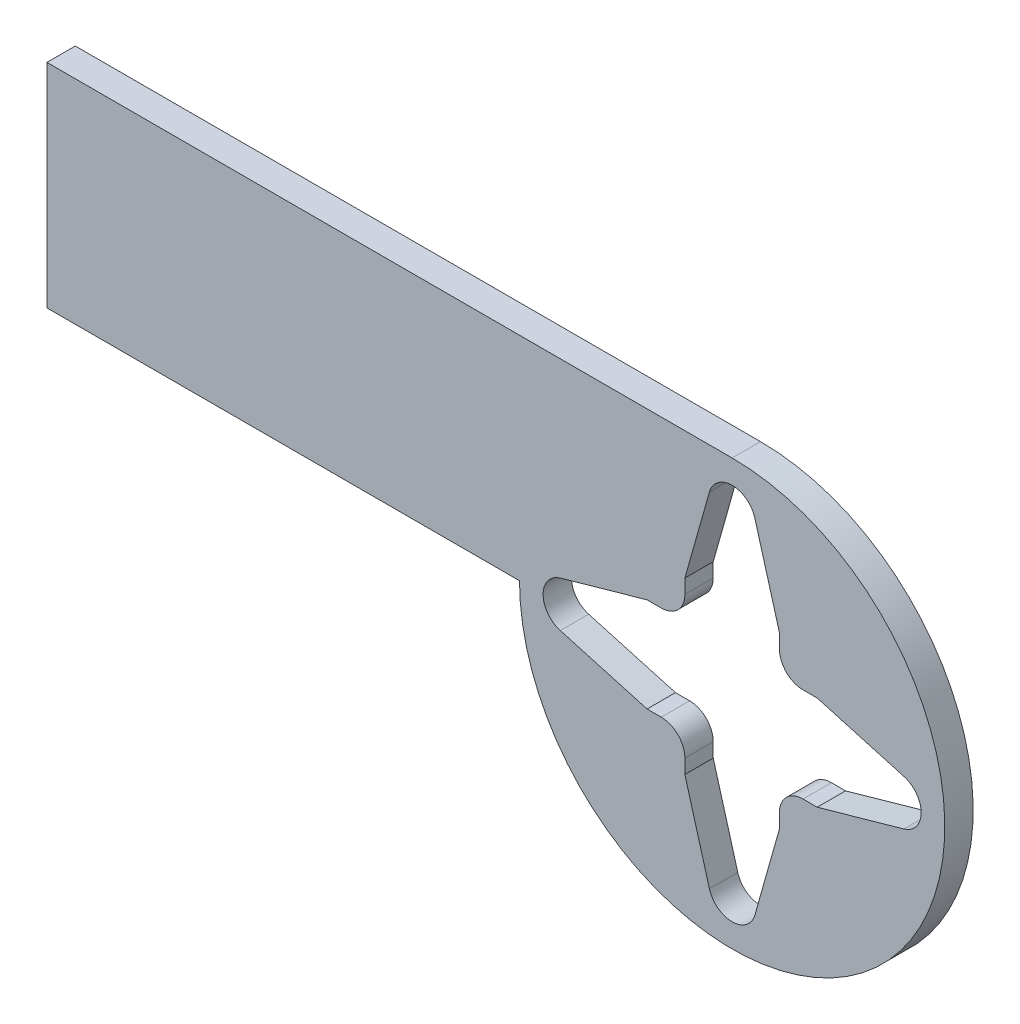
from build123d import *

# Parameters (mm, degrees)
SKETCH1_R           = 2.5
SKETCH1_W           = 50
SKETCH1_H           = 22.5
BOSS_EXTRUDE1_DEPTH = 3


with BuildPart() as part:
    # Sketch1 → Boss-Extrude1 (new body)
    # profile 1 of 7: a face of its own
    with BuildSketch(Plane.XY):
        with BuildLine():
            ThreePointArc((22.5, 0), (15.909902577, 15.909902577), (0, 22.5))
            Line((0, 22.5), (-22.5, 0))
            ThreePointArc((-22.5, 0), (-22.471786645, -1.126412439), (-22.387217335, -2.25))
            ThreePointArc((-22.387217335, -2.25), (1.126412439, -22.471786645), (22.5, 0))
        make_face()
        with BuildLine():
            ThreePointArc((-7.5, 5), (-9.267766953, 9.267766953), (-5, 7.5))
            Line((-5, 7.5), (-5, 9))
            Line((-5, 9), (-2.405779746, 18.179870439))
            ThreePointArc((-2.405779746, 18.179870439), (0, 20), (2.405779746, 18.179870439))
            Line((2.405779746, 18.179870439), (5, 9))
            Line((5, 9), (5, 7.5))
            ThreePointArc((5, 7.5), (7.5, 10), (10, 7.5))
            ThreePointArc((10, 7.5), (9.267766953, 5.732233047), (7.5, 5))
            Line((7.5, 5), (9, 5))
            Line((9, 5), (18.179870439, 2.405779746))
            ThreePointArc((18.179870439, 2.405779746), (19.493699588, 1.508363998), (20, 0))
            ThreePointArc((20, 0), (19.493699588, -1.508363998), (18.179870439, -2.405779746))
            Line((18.179870439, -2.405779746), (9, -5))
            Line((9, -5), (7.5, -5))
            ThreePointArc((7.5, -5), (9.267766953, -5.732233047), (10, -7.5))
            ThreePointArc((10, -7.5), (7.5, -10), (5, -7.5))
            Line((5, -7.5), (5, -9))
            Line((5, -9), (2.405779746, -18.179870439))
            ThreePointArc((2.405779746, -18.179870439), (0, -20), (-2.405779746, -18.179870439))
            Line((-2.405779746, -18.179870439), (-5, -9))
            Line((-5, -9), (-5, -7.5))
            ThreePointArc((-5, -7.5), (-9.267766953, -9.267766953), (-7.5, -5))
            Line((-7.5, -5), (-9, -5))
            Line((-9, -5), (-18.179870439, -2.405779746))
            ThreePointArc((-18.179870439, -2.405779746), (-20, 0), (-18.179870439, 2.405779746))
            Line((-18.179870439, 2.405779746), (-9, 5))
            Line((-9, 5), (-7.5, 5))
        make_face(mode=Mode.SUBTRACT)
    # profile 2 of 7: a face of its own
    with BuildSketch(Plane.XY):
        with Locations((-7.5, 7.5)):
            Circle(SKETCH1_R)
    # profile 3 of 7: a face of its own
    with BuildSketch(Plane.XY):
        with Locations((7.5, 7.5)):
            Circle(SKETCH1_R)
    # profile 4 of 7: a face of its own
    with BuildSketch(Plane.XY):
        with Locations((7.5, -7.5)):
            Circle(SKETCH1_R)
    # profile 5 of 7: a face of its own
    with BuildSketch(Plane.XY):
        with Locations((-7.5, -7.5)):
            Circle(SKETCH1_R)
    # profile 6 of 7: a face of its own
    with BuildSketch(Plane.XY):
        Polygon((-22.5, 22.5), (0, 22.5), (-22.5, 0), align=None)
    # profile 7 of 7: a face of its own
    with BuildSketch(Plane.XY):
        with Locations((-47.5, 11.25)):
            Rectangle(SKETCH1_W, SKETCH1_H)
    extrude(amount=BOSS_EXTRUDE1_DEPTH)


solid = part.part
